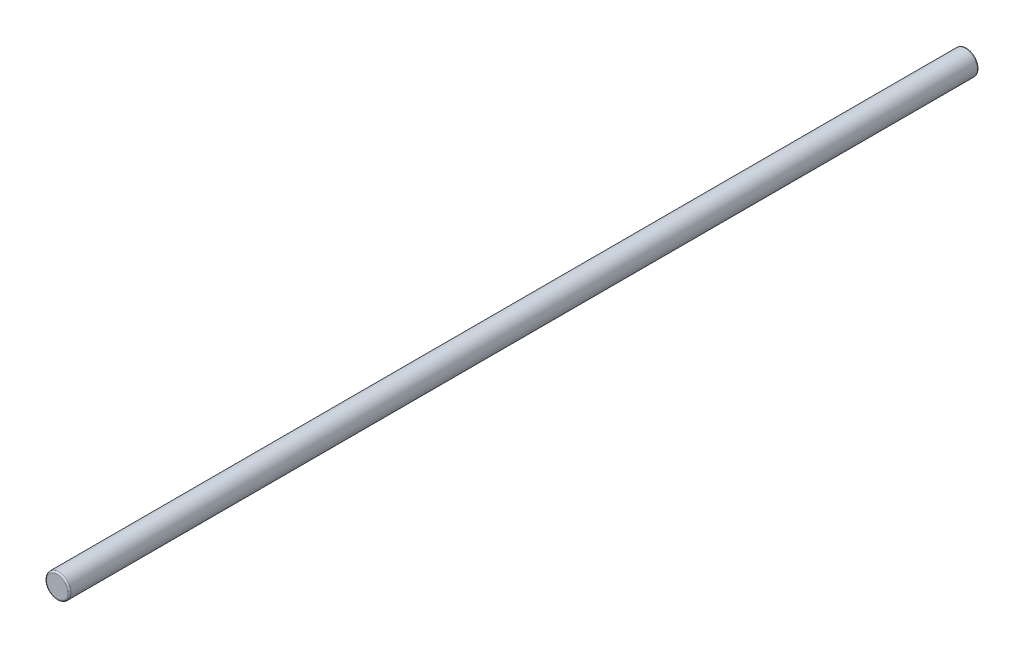
from build123d import *

# Parameters (mm, degrees)
CROQUIS1_R              = 4
SALIENTE_EXTRUIR1_DEPTH = 300
REDONDEO1_R             = 0.5


with BuildPart() as part:
    # Croquis1 → Saliente-Extruir1 (new body)
    with BuildSketch(Plane.XY):
        Circle(CROQUIS1_R)
    extrude(amount=SALIENTE_EXTRUIR1_DEPTH)

    # Redondeo1
    redondeo1_edges = [part.edges().sort_by_distance(p)[0] for p in [
        (-4, 0, 0),
        (-4, 0, 300),
    ]]
    fillet(redondeo1_edges, radius=REDONDEO1_R)


solid = part.part
